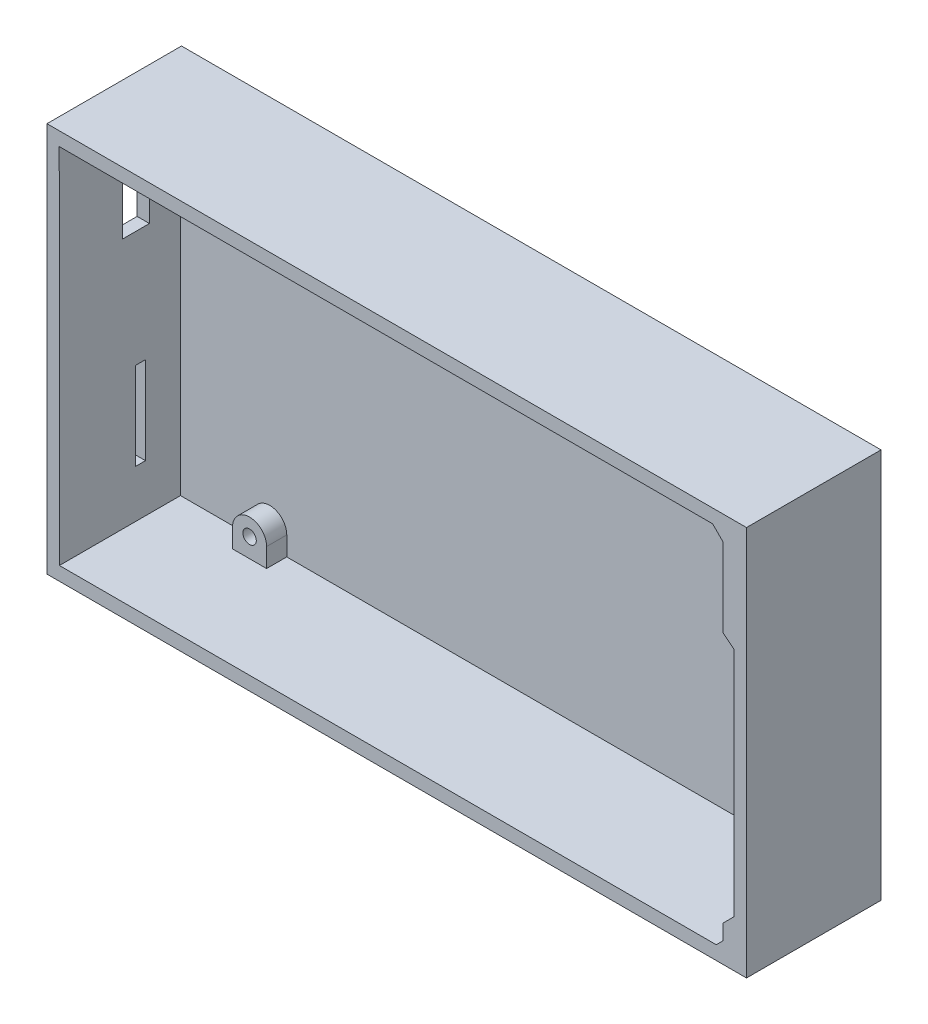
from build123d import *

# Parameters (mm, degrees)
SKETCH_3_W               = 104
SKETCH_3_H               = 58
EXTRUDE_1_DEPTH          = 20
SKETCH_3_R               = 1.5
EXTRUDE_1_2_DEPTH        = 20
EXTRUDE_1_3_DEPTH        = 20
EXTRUDE_1_4_DEPTH        = 20
EXTRUDE_1_5_DEPTH        = 20
SKETCH_4_W               = 104
SKETCH_4_H               = 58
EXTRUDE_2_DEPTH          = 2
EXTRUDE_3_DEPTH          = 3
CUT_EXTRUDE_1_DEPTH      = 118.034964822
CUT_EXTRUDE_1_DEPTH_BACK = 118.034964822
SKETCH_6_R               = 1.5
SKETCH_7_R               = 1.6263635
SKETCH_7_R_2             = 1
EXTRUDE_4_DEPTH          = 5
SKETCH_8_W               = 4
SKETCH_8_H               = 10
CUT_EXTRUDE_2_DEPTH      = 1.274832
SKETCH_9_W               = 4
SKETCH_9_H               = 8
EXTRUDE_5_DEPTH          = 4
SKETCH_11_W              = 4
SKETCH_11_H              = 5.77137
EXTRUDE_7_DEPTH          = 1.82408674
CUT_EXTRUDE_3_REACH      = 123.535
SKETCH_13_W              = 4
SKETCH_13_H              = 8
SKETCH_14_W              = 2
SKETCH_14_H              = 13
EXTRUDE_8_DEPTH          = 2.2
CUT_EXTRUDE_4_REACH      = 123.385
SKETCH_15_W              = 1.5
SKETCH_15_H              = 13
SKETCH_16_W              = 7.456454352
SKETCH_16_H              = 15.223594302
CUT_EXTRUDE_5_DEPTH      = 2


with BuildPart() as part:
    # 草图3 → 凸台-拉伸1 (new body)
    with BuildSketch(Plane.XY):
        with Locations((49.851592, 26.6635985)):
            Rectangle(SKETCH_3_W, SKETCH_3_H)
        Polygon((97.359934, -0.3), (-0.3, -0.3), (-0.32567, 53.627197), (96.810253, 53.627197), (98.334256, 52.103194), (98.334256, 40.373171), (100.016019, 39.036416919), (100.016019, 4.64681), (98.334516, 2.965177), (98.334516, 0.686792), align=None, mode=Mode.SUBTRACT)
    extrude(amount=EXTRUDE_1_DEPTH)



with BuildPart() as body_2:
    # 草图3 → Extrude 1 2 (new body)
    with BuildSketch(Plane.XY):
        with Locations((89.1699285, 50.800132)):
            Circle(SKETCH_3_R)
    extrude(amount=EXTRUDE_1_2_DEPTH)


with BuildPart() as body_3:
    # 草图3 → Extrude 1 3 (new body)
    with BuildSketch(Plane.XY):
        with Locations((95.519941, 2.540035)):
            Circle(SKETCH_3_R)
    extrude(amount=EXTRUDE_1_3_DEPTH)


with BuildPart() as body_4:
    # 草图3 → Extrude 1 4 (new body)
    with BuildSketch(Plane.XY):
        with Locations((12.970026, 2.540035)):
            Circle(SKETCH_3_R)
    extrude(amount=EXTRUDE_1_4_DEPTH)


with BuildPart() as body_5:
    # 草图3 → Extrude 1 5 (new body)
    with BuildSketch(Plane.XY):
        with Locations((14.2448585, 50.793782)):
            Circle(SKETCH_3_R)
    extrude(amount=EXTRUDE_1_5_DEPTH)


with BuildPart() as part_1:
    add(part.part)

    add(body_2.part)  # 凸台-拉伸2 merges body 2

    add(body_3.part)  # 凸台-拉伸2 merges body 3

    add(body_4.part)  # 凸台-拉伸2 merges body 4

    add(body_5.part)  # 凸台-拉伸2 merges body 5
    # 草图4 → 凸台-拉伸2 (add)
    with BuildSketch(Plane(origin=(0, 0, 0), x_dir=(-1, 0, 0), z_dir=(0, 0, -1))):
        with Locations((-49.851592, 26.6635985)):
            Rectangle(SKETCH_4_W, SKETCH_4_H)
    extrude(amount=-EXTRUDE_2_DEPTH)

    # 草图5 → 凸台-拉伸3 (add)
    with BuildSketch(Plane.XY.offset(2)):
        with BuildLine():
            Line((16.7782735, 50.793782), (16.7782735, 53.627197))
            Line((16.7782735, 53.627197), (11.7114435, 53.627197))
            Line((11.7114435, 53.627197), (11.7114435, 50.793782))
            ThreePointArc((11.7114435, 50.793782), (14.2448585, 48.260367), (16.7782735, 50.793782))
        make_face()
        with BuildLine():
            Line((86.6365135, 50.800132), (86.6365135, 53.633547))
            Line((86.6365135, 53.633547), (91.7033435, 53.633547))
            Line((91.7033435, 53.633547), (91.7033435, 50.800132))
            ThreePointArc((91.7033435, 50.800132), (89.1699285, 48.266717), (86.6365135, 50.800132))
        make_face()
        with BuildLine():
            Line((15.503441, 2.540035), (15.503441, -0.29338))
            Line((15.503441, -0.29338), (10.436611, -0.29338))
            Line((10.436611, -0.29338), (10.436611, 2.540035))
            ThreePointArc((10.436611, 2.540035), (12.970026, 5.07345), (15.503441, 2.540035))
        make_face()
        with BuildLine():
            Line((92.986526, -0.29338), (98.053356, -0.29338))
            Line((98.053356, -0.29338), (98.605799849, -0.29338))
            Line((98.605799849, -0.29338), (100.016019, 4.64681))
            Line((100.016019, 4.64681), (98.334516, 2.965177))
            Line((98.334516, 2.965177), (98.049480092, 2.680119056))
            ThreePointArc((98.049480092, 2.680119056), (95.449872167, 5.072480838), (92.986526, 2.540035))
            Line((92.986526, 2.540035), (92.986526, -0.29338))
        make_face()
    extrude(amount=EXTRUDE_3_DEPTH)

    # 草图6 → 切除-拉伸1 (cut, two sides: drawn at the far end of the back side and taken through both)
    with BuildSketch(Plane.XY.offset(5).offset(-CUT_EXTRUDE_1_DEPTH_BACK)):
        with Locations((14.2448585, 50.793782)):
            Circle(SKETCH_6_R)
        with Locations((89.1699285, 50.800132)):
            Circle(SKETCH_6_R)
        with Locations((12.970026, 2.540035)):
            Circle(SKETCH_6_R)
        with Locations((95.519941, 2.540035)):
            Circle(SKETCH_6_R)
    extrude(amount=CUT_EXTRUDE_1_DEPTH + CUT_EXTRUDE_1_DEPTH_BACK, mode=Mode.SUBTRACT)

    # 草图7 → 凸台-拉伸4 (add)
    # profile 1 of 4: a face of its own
    with BuildSketch(Plane.XY.offset(5)):
        with Locations((14.2448585, 50.793782)):
            Circle(SKETCH_7_R)
        with Locations((14.2448585, 50.793782)):
            Circle(SKETCH_7_R_2, mode=Mode.SUBTRACT)
    # profile 2 of 4: a face of its own
    with BuildSketch(Plane.XY.offset(5)):
        with Locations((89.1699285, 50.800132)):
            Circle(SKETCH_7_R)
        with Locations((89.1699285, 50.800132)):
            Circle(SKETCH_7_R_2, mode=Mode.SUBTRACT)
    # profile 3 of 4: a face of its own
    with BuildSketch(Plane.XY.offset(5)):
        with Locations((95.519941, 2.540035)):
            Circle(SKETCH_7_R)
        with Locations((95.519941, 2.540035)):
            Circle(SKETCH_7_R_2, mode=Mode.SUBTRACT)
    # profile 4 of 4: a face of its own
    with BuildSketch(Plane.XY.offset(5)):
        with Locations((12.970026, 2.540035)):
            Circle(SKETCH_7_R)
        with Locations((12.970026, 2.540035)):
            Circle(SKETCH_7_R_2, mode=Mode.SUBTRACT)
    extrude(amount=-EXTRUDE_4_DEPTH)

    # 草图8 → 切除-拉伸2 (cut)
    with BuildSketch(Plane(origin=(16.7782735, 0, 0), x_dir=(0, 0, -1), z_dir=(1, 0, 0))):
        with Locations((-8.6, 45.793782)):
            Rectangle(SKETCH_8_W, SKETCH_8_H)
    extrude(amount=-CUT_EXTRUDE_2_DEPTH, mode=Mode.SUBTRACT)

    # 草图9 → 凸台-拉伸5 (add)
    with BuildSketch(Plane.XY.offset(6.6)):
        with Locations((-2.319669969, 41.022412)):
            Rectangle(SKETCH_9_W, SKETCH_9_H)
    extrude(amount=EXTRUDE_5_DEPTH)

    # 草图11 → 凸台-拉伸7 (add)
    with BuildSketch(Plane.ZY.offset(2.148408)):
        with Locations((8.6, 47.908097)):
            Rectangle(SKETCH_11_W, SKETCH_11_H)
    extrude(amount=-EXTRUDE_7_DEPTH)

    # 切除-拉伸3: up to this plane
    cut_extrude_3_end = Plane(origin=(-0.300142736, -0.000142872, 20), z_dir=(-0.9999998867062445, -0.00047601207776012256, 0))
    # 草图13 → 切除-拉伸3 (cut, up to the surface)
    with BuildSketch(Plane.ZY.offset(4.319669969), mode=Mode.PRIVATE) as cut_extrude_3_sk1:
        with Locations((8.6, 41.022412)):
            Rectangle(SKETCH_13_W, SKETCH_13_H)
    cut_extrude_3_tool1 = split(extrude(cut_extrude_3_sk1.sketch, amount=-CUT_EXTRUDE_3_REACH, mode=Mode.PRIVATE), bisect_by=cut_extrude_3_end, keep=Keep.BOTH, mode=Mode.PRIVATE)
    add(cut_extrude_3_tool1.solids().sort_by_distance((-4.31967, 41.022412, 8.6))[0], mode=Mode.SUBTRACT)


with BuildPart() as cut_extrude_3_kept_piece:
    # of the separate pieces the step leaves, the one the design keeps (cut_extrude_3_pieces_kept)
    add(part_1.part.solids().sort_by_distance((-2.148408, -2.3364015, 0))[0])

    # 草图14 → 凸台-拉伸8 (add)
    with BuildSketch(Plane.XY.offset(5)):
        with Locations((-3.148408, 13.296995)):
            Rectangle(SKETCH_14_W, SKETCH_14_H)
    extrude(amount=EXTRUDE_8_DEPTH)

    # 切除-拉伸4: up to this plane
    cut_extrude_4_end = Plane(origin=(-0.300142736, -0.000142872, 20), z_dir=(-0.9999998867062445, -0.00047601207776012256, 0))
    # 草图15 → 切除-拉伸4 (cut, up to the surface)
    with BuildSketch(Plane.ZY.offset(4.148408), mode=Mode.PRIVATE) as cut_extrude_4_sk1:
        with Locations((7.95, 13.296995)):
            Rectangle(SKETCH_15_W, SKETCH_15_H)
    cut_extrude_4_tool1 = split(extrude(cut_extrude_4_sk1.sketch, amount=-CUT_EXTRUDE_4_REACH, mode=Mode.PRIVATE), bisect_by=cut_extrude_4_end, keep=Keep.BOTH, mode=Mode.PRIVATE)
    add(cut_extrude_4_tool1.solids().sort_by_distance((-4.148408, 13.296995, 7.95))[0], mode=Mode.SUBTRACT)

    # 草图16 → 切除-拉伸5 (cut)
    with BuildSketch(Plane.ZY.offset(2.148408)):
        with Locations((6.989585085, 13.226446387)):
            Rectangle(SKETCH_16_W, SKETCH_16_H)
    extrude(amount=CUT_EXTRUDE_5_DEPTH, mode=Mode.SUBTRACT)


solid = cut_extrude_3_kept_piece.part
